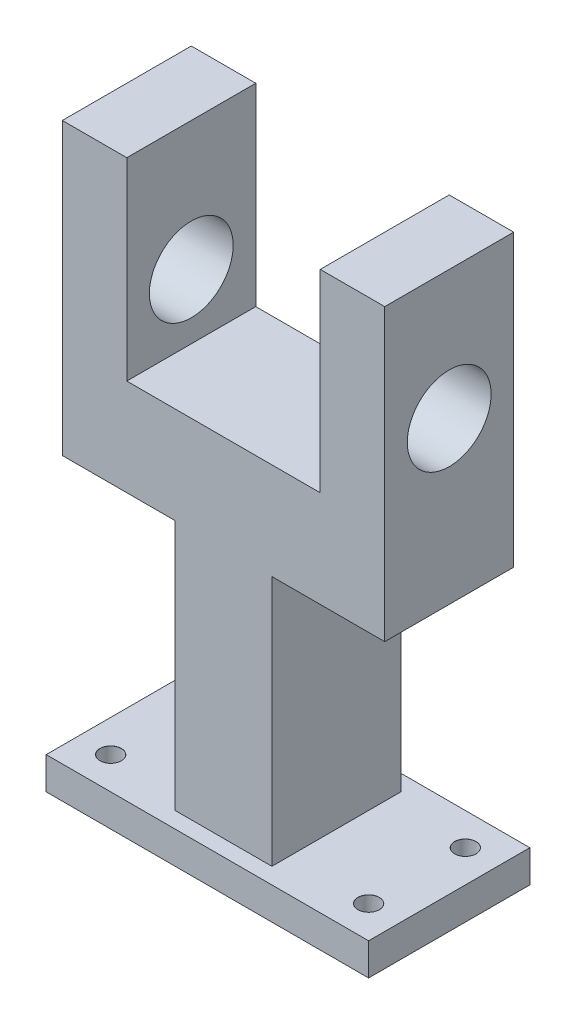
from build123d import *

# Parameters (mm, degrees)
SKETCH1_W                      = 100
SKETCH1_H                      = 50
BOSS_EXTRUDE1_DEPTH            = 10
M6_CLEARANCE_HOLE1_D           = 6.6
M6_CLEARANCE_HOLE1_CSINK_D     = 6.65
M6_CLEARANCE_HOLE1_CSINK_ANGLE = 100
SKETCH4_W                      = 30
SKETCH4_H                      = 40
BOSS_EXTRUDE2_DEPTH            = 107.84
BOSS_EXTRUDE3_DEPTH            = 50
BOSS_EXTRUDE3_DEPTH_BACK       = 50
SKETCH6_W                      = 40
SKETCH6_H                      = 30
SKETCH7_W                      = 20
SKETCH7_H                      = 40
BOSS_EXTRUDE4_DEPTH            = 60
SKETCH8_R                      = 13
CUT_EXTRUDE3_DEPTH             = 206.553072465


with BuildPart() as part:
    # Sketch1 → Boss-Extrude1 (new body)
    with BuildSketch(Plane(origin=(0, 0, 0), x_dir=(1, 0, 0), z_dir=(0, 1, 0))):
        Rectangle(SKETCH1_W, SKETCH1_H)
    extrude(amount=BOSS_EXTRUDE1_DEPTH)

    # M6 Clearance Hole1 (through all)
    with Locations(Plane(origin=(0, 10, 0), x_dir=(1, 0, 0), z_dir=(0, 1, 0))):
        with Locations((-40, 15), (40, 15), (-40, -15), (40, -15)):
            CounterSinkHole(M6_CLEARANCE_HOLE1_D / 2, M6_CLEARANCE_HOLE1_CSINK_D / 2, counter_sink_angle=M6_CLEARANCE_HOLE1_CSINK_ANGLE)

    # Sketch4 → Boss-Extrude2 (add)
    with BuildSketch(Plane(origin=(0, 10, 0), x_dir=(1, 0, 0), z_dir=(0, 1, 0))):
        Rectangle(SKETCH4_W, SKETCH4_H)
    extrude(amount=BOSS_EXTRUDE2_DEPTH)

    # Sketch6 → Boss-Extrude3 (add, two sides: drawn at the far end of the back side and taken through both)
    with BuildSketch(Plane(origin=(0, 0, 0), x_dir=(0, 0, -1), z_dir=(1, 0, 0)).offset(-BOSS_EXTRUDE3_DEPTH_BACK)):
        with Locations((0, 102.84)):
            Rectangle(SKETCH6_W, SKETCH6_H)
    extrude(amount=BOSS_EXTRUDE3_DEPTH + BOSS_EXTRUDE3_DEPTH_BACK)

    # Sketch7 → Boss-Extrude4 (add)
    with BuildSketch(Plane(origin=(0, 117.84, 0), x_dir=(1, 0, 0), z_dir=(0, 1, 0))):
        with Locations((-40, 0)):
            Rectangle(SKETCH7_W, SKETCH7_H)
        with Locations((40, 0)):
            Rectangle(SKETCH7_W, SKETCH7_H)
    extrude(amount=BOSS_EXTRUDE4_DEPTH)

    # Sketch8 → Cut-Extrude3 (cut, through all)
    with BuildSketch(Plane.ZY.offset(50)):
        with Locations((0, 137.84)):
            Circle(SKETCH8_R)
    extrude(amount=-CUT_EXTRUDE3_DEPTH, mode=Mode.SUBTRACT)


solid = part.part
